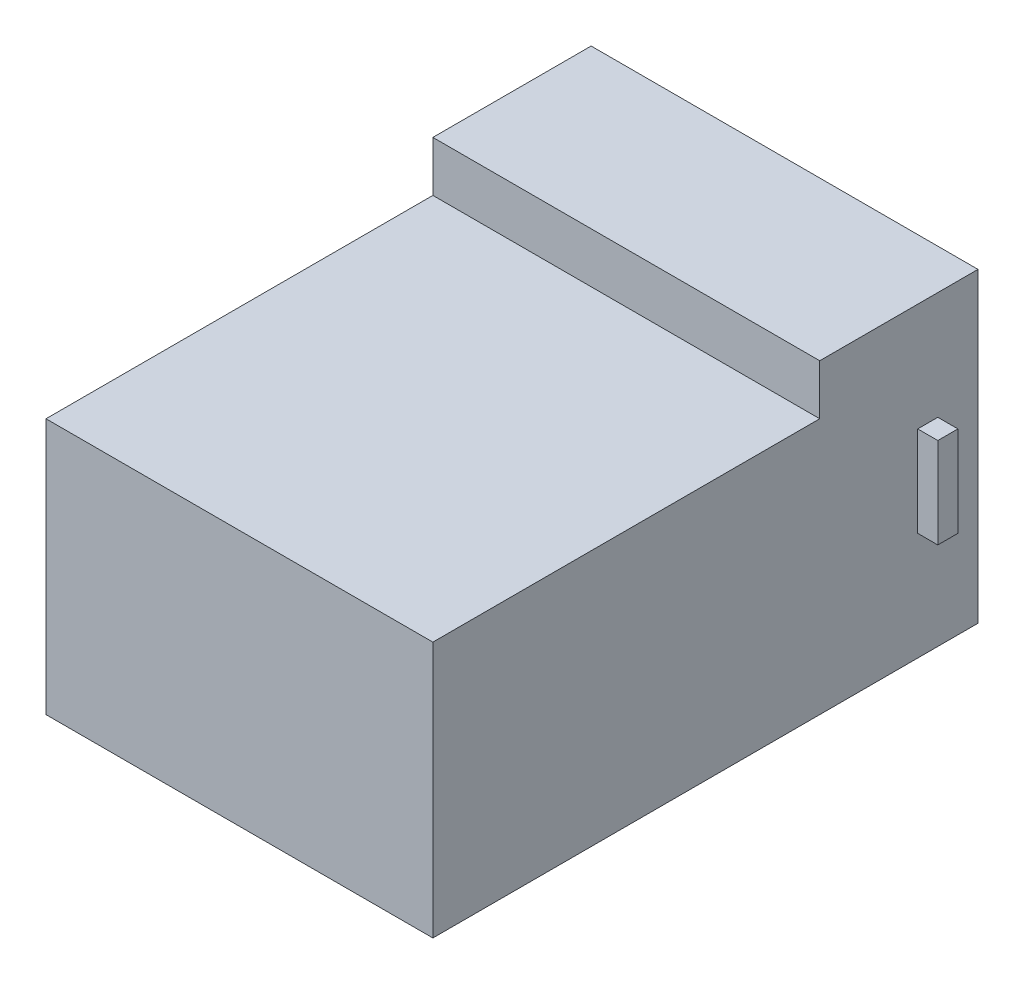
from build123d import *

# Parameters (mm, degrees)
SKETCH_1_W          = 77
SKETCH_1_H          = 61
EXTRUDE_1_DEPTH     = 108.5
SKETCH_2_W          = 77
SKETCH_2_H          = 77
CUT_EXTRUDE_1_DEPTH = 10
SKETCH_3_W          = 85
SKETCH_3_H          = 4
EXTRUDE_2_DEPTH     = 18


with BuildPart() as part:
    # 草图1 → 凸台-拉伸1 (new body)
    with BuildSketch(Plane.XY):
        with Locations((38.5, 30.5)):
            Rectangle(SKETCH_1_W, SKETCH_1_H)
    extrude(amount=EXTRUDE_1_DEPTH)

    # 草图2 → 切除-拉伸1 (cut)
    with BuildSketch(Plane(origin=(0, 61, 0), x_dir=(1, 0, 0), z_dir=(0, 1, 0))):
        with Locations((38.5, -70)):
            Rectangle(SKETCH_2_W, SKETCH_2_H)
    extrude(amount=-CUT_EXTRUDE_1_DEPTH, mode=Mode.SUBTRACT)

    # 草图3 → 凸台-拉伸2 (add)
    with BuildSketch(Plane(origin=(0, 21.5, 0), x_dir=(-1, 0, 0), z_dir=(0, -1, 0))):
        with Locations((-38.5, -10)):
            Rectangle(SKETCH_3_W, SKETCH_3_H)
    extrude(amount=-EXTRUDE_2_DEPTH)


solid = part.part
